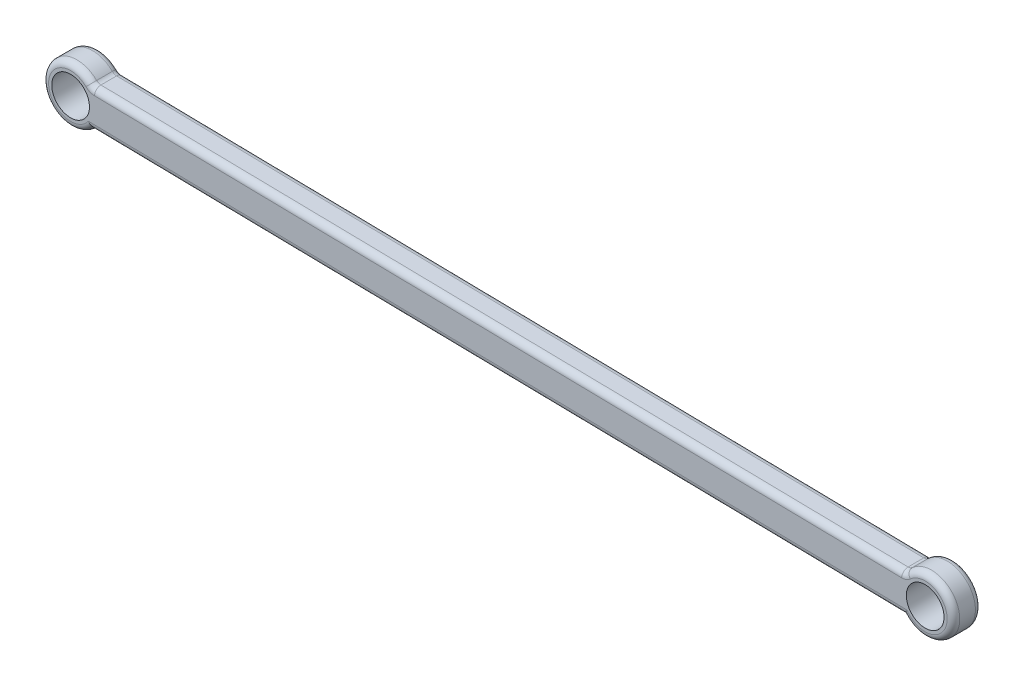
from build123d import *

# Parameters (mm, degrees)
SKETCH1_R           = 3
BOSS_EXTRUDE1_DEPTH = 4.5
FILLET3_R           = 1


with BuildPart() as part:
    # Sketch1 → Boss-Extrude1 (new body)
    with BuildSketch(Plane.XY):
        with BuildLine():
            Line((3.405090972, 2.94199855), (132.677847476, 0.723224952))
            ThreePointArc((132.677847476, 0.723224952), (140.479309911, -2.411117334), (132.574881611, -5.275891486))
            Line((132.574881611, -5.275891486), (3.302125107, -3.057117887))
            ThreePointArc((3.302125107, -3.057117887), (-4.499337328, 0.077224399), (3.405090972, 2.94199855))
        make_face()
        Circle(SKETCH1_R, mode=Mode.SUBTRACT)
        with Locations((135.979972583, -2.333892935)):
            Circle(SKETCH1_R, mode=Mode.SUBTRACT)
    extrude(amount=BOSS_EXTRUDE1_DEPTH)

    # Fillet3
    fillet3_edges = [part.edges().sort_by_distance(p)[0] for p in [
        (3.405090972, 2.94199855, 2.25),
        (132.677847476, 0.723224952, 2.25),
        (67.938503359, -4.166504686, 4.5),
        (140.479309911, -2.411117334, 4.5),
        (68.041469224, 1.832611751, 4.5),
        (-4.499337328, 0.077224399, 4.5),
        (-4.499337328, 0.077224399, 0),
        (68.041469224, 1.832611751, 0),
        (140.479309911, -2.411117334, 0),
        (67.938503359, -4.166504686, 0),
    ]]
    fillet(fillet3_edges, radius=FILLET3_R)


solid = part.part
